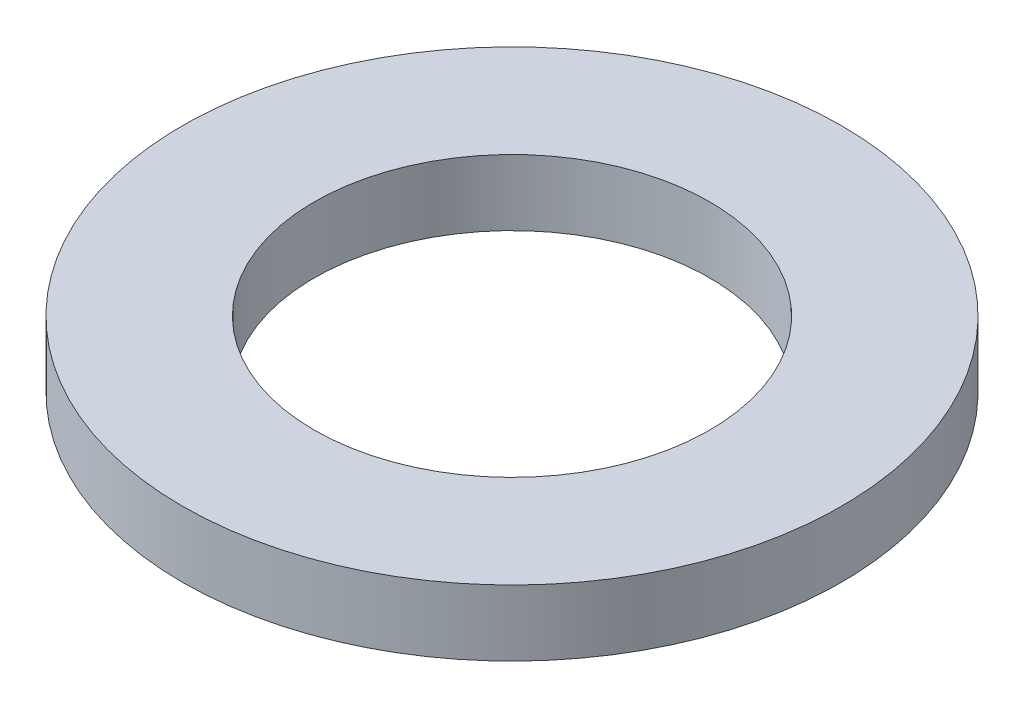
from build123d import *

# Parameters (mm, degrees)
SKETCH1_R           = 10
SKETCH1_R_2         = 6
BOSS_EXTRUDE1_DEPTH = 2


with BuildPart() as part:
    # Sketch1 → Boss-Extrude1 (new body)
    with BuildSketch(Plane(origin=(0, 0, 0), x_dir=(1, 0, 0), z_dir=(0, 1, 0))):
        with Locations(Location((0, 0, 0), (0, 0, 270))):
            Circle(SKETCH1_R)
        with Locations(Location((0, 0, 0), (0, 0, 270))):
            Circle(SKETCH1_R_2, mode=Mode.SUBTRACT)
    extrude(amount=BOSS_EXTRUDE1_DEPTH)


solid = part.part
